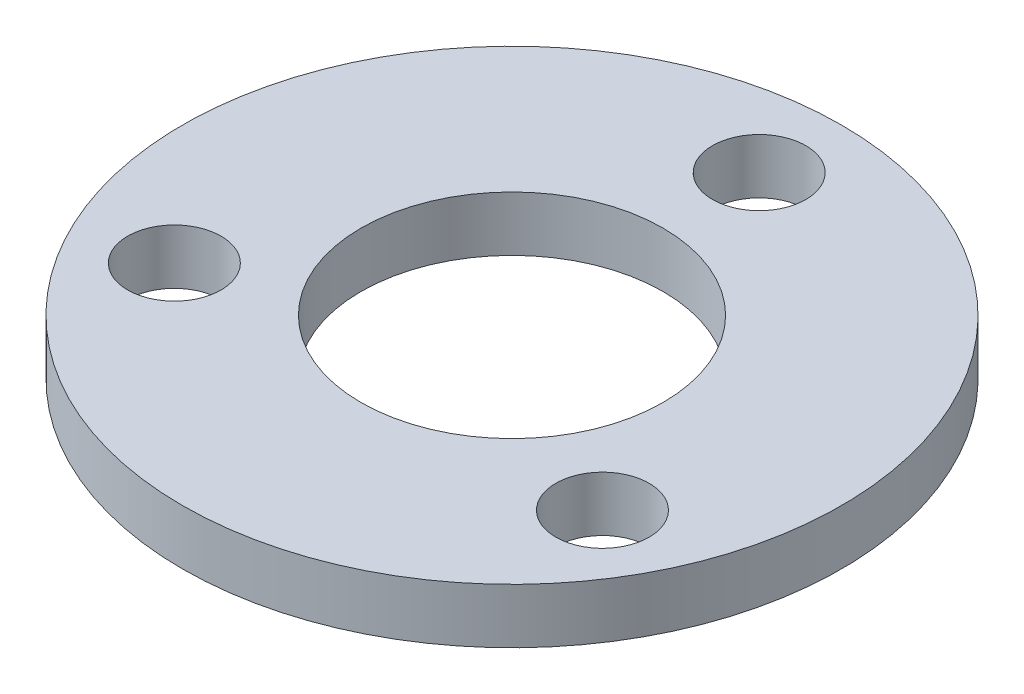
from build123d import *

# Parameters (mm, degrees)
SKETCH_1_R      = 12
SKETCH_1_R_2    = 1.7
SKETCH_1_R_3    = 5.5
EXTRUDE_1_DEPTH = 2


with BuildPart() as part:
    # Эскиз1 → Бобышка-Вытянуть1 (new body)
    with BuildSketch(Plane(origin=(0, 0, 0), x_dir=(1, 0, 0), z_dir=(0, 1, 0))):
        with Locations(Location((0, 0, 0), (0, 0, 270))):
            Circle(SKETCH_1_R)
        with Locations(Location((0, 9, 0), (0, 0, 270))):
            Circle(SKETCH_1_R_2, mode=Mode.SUBTRACT)
        with Locations(Location((7.794228634, -4.5, 0), (0, 0, 270))):
            Circle(SKETCH_1_R_2, mode=Mode.SUBTRACT)
        with Locations(Location((-7.794228634, -4.5, 0), (0, 0, 270))):
            Circle(SKETCH_1_R_2, mode=Mode.SUBTRACT)
        with Locations(Location((0, 0, 0), (0, 0, 270))):
            Circle(SKETCH_1_R_3, mode=Mode.SUBTRACT)
    extrude(amount=EXTRUDE_1_DEPTH)


solid = part.part
